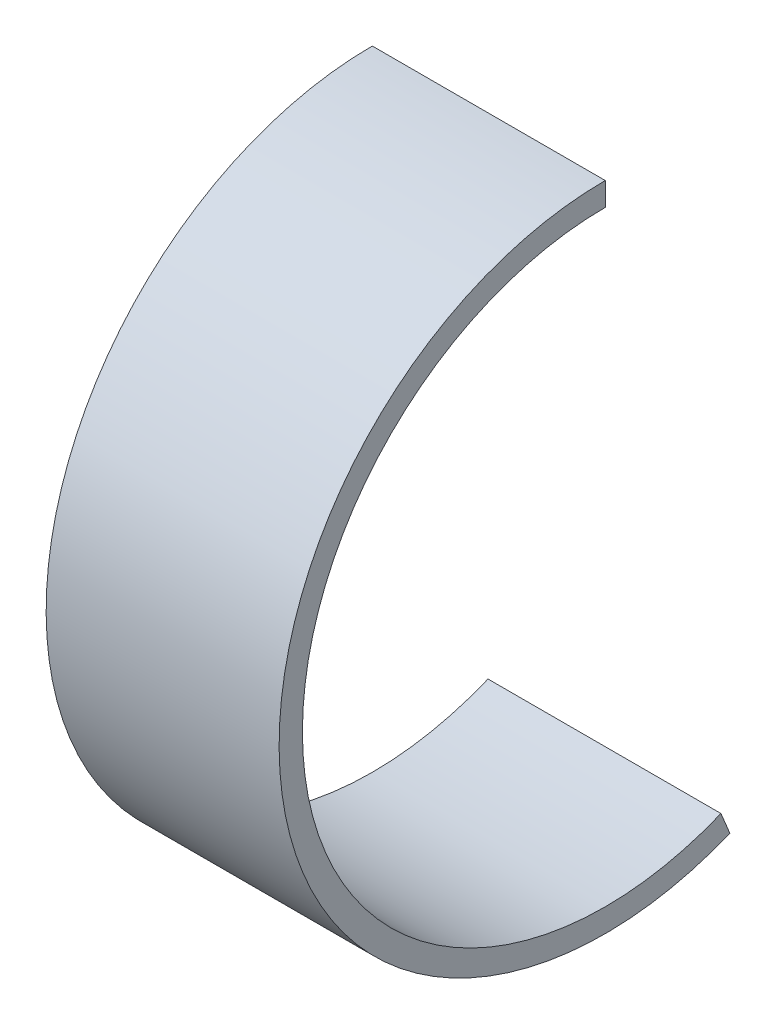
from build123d import *

# Parameters (mm, degrees)
EXTRUDE_THIN1_DEPTH = 508


with BuildPart() as part:
    # Sketch1 → Extrude-Thin1 (new body)
    with BuildSketch(Plane(origin=(0, 0, 0), x_dir=(0, 0, -1), z_dir=(1, 0, 0))):
        with BuildLine():
            ThreePointArc((0, 660.4), (-647.757439178, -128.601943958), (252.280029956, -610.313809843))
            Line((252.280029956, -610.313809843), (271.686186107, -657.261025985))
            ThreePointArc((271.686186107, -657.261025985), (-697.584934499, -138.494401185), (0, 711.2))
            Line((0, 711.2), (0, 660.4))
        make_face()
    extrude(amount=EXTRUDE_THIN1_DEPTH)


solid = part.part
